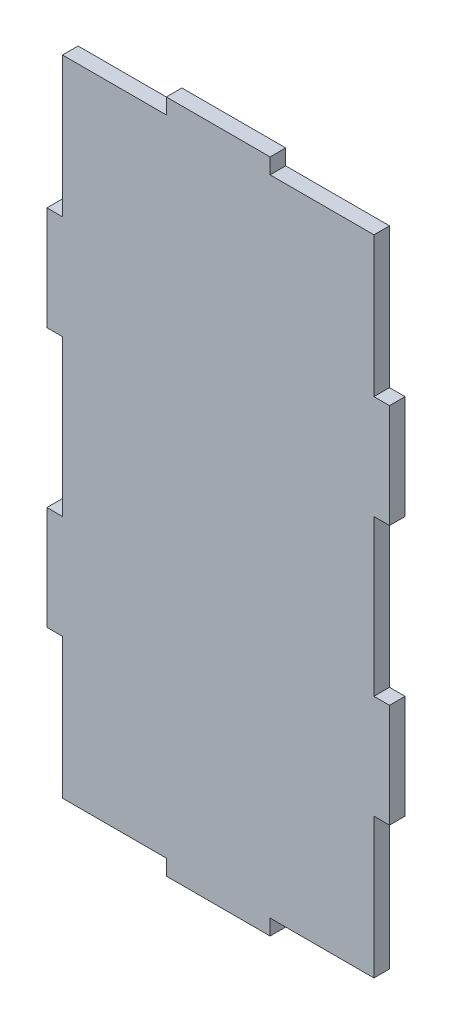
from build123d import *

# Parameters (mm, degrees)
ESQUISSE1_W        = 20
ESQUISSE1_H        = 3
ESQUISSE1_W_2      = 3
ESQUISSE1_H_2      = 20
BOSS_EXTRU_1_DEPTH = 3


with BuildPart() as part:
    # Esquisse1 → Boss.-Extru.1 (new body)
    with BuildSketch(Plane.XY):
        Polygon((10, -62), (30, -62), (30, -35), (27, -35), (27, -15), (30, -15), (30, 15), (27, 15), (27, 35), (30, 35), (30, 62), (10, 62), (10, 59), (-10, 59), (-10, 62), (-30, 62), (-30, 35), (-27, 35), (-27, 15), (-30, 15), (-30, -15), (-27, -15), (-27, -35), (-30, -35), (-30, -62), (-10, -62), (-10, -59), (10, -59), align=None)
        with Locations((0, 60.5)):
            Rectangle(ESQUISSE1_W, ESQUISSE1_H)
        with Locations((0, 63.5)):
            Rectangle(ESQUISSE1_W, ESQUISSE1_H)
        with Locations((-28.5, 25)):
            Rectangle(ESQUISSE1_W_2, ESQUISSE1_H_2)
        with Locations((-31.5, 25)):
            Rectangle(ESQUISSE1_W_2, ESQUISSE1_H_2)
        with Locations((31.5, 25)):
            Rectangle(ESQUISSE1_W_2, ESQUISSE1_H_2)
        with Locations((28.5, 25)):
            Rectangle(ESQUISSE1_W_2, ESQUISSE1_H_2)
        with Locations((31.5, -25)):
            Rectangle(ESQUISSE1_W_2, ESQUISSE1_H_2)
        with Locations((28.5, -25)):
            Rectangle(ESQUISSE1_W_2, ESQUISSE1_H_2)
        with Locations((0, -60.5)):
            Rectangle(ESQUISSE1_W, ESQUISSE1_H)
        with Locations((0, -63.5)):
            Rectangle(ESQUISSE1_W, ESQUISSE1_H)
        with Locations((-28.5, -25)):
            Rectangle(ESQUISSE1_W_2, ESQUISSE1_H_2)
        with Locations((-31.5, -25)):
            Rectangle(ESQUISSE1_W_2, ESQUISSE1_H_2)
    extrude(amount=BOSS_EXTRU_1_DEPTH)


solid = part.part
